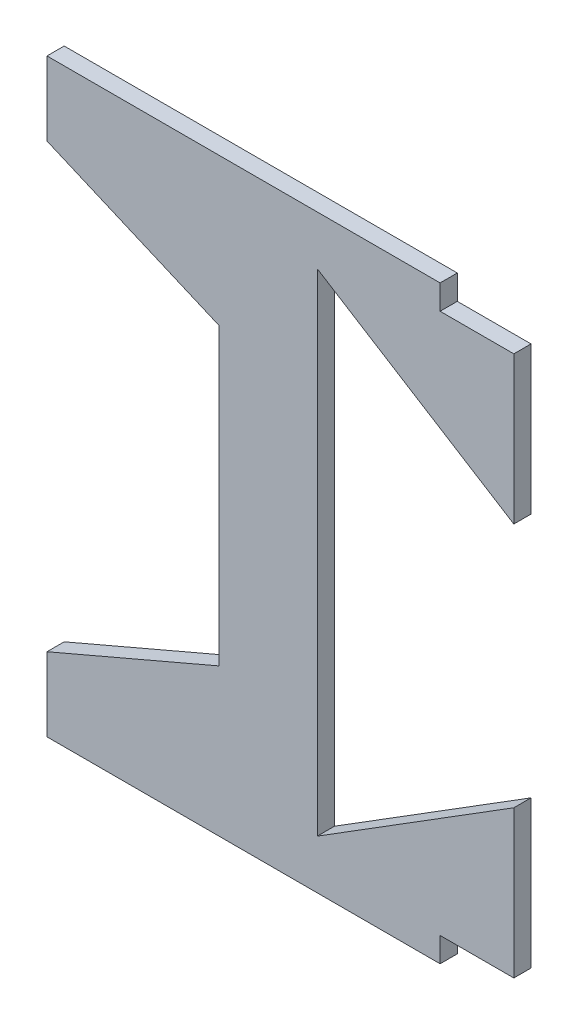
from build123d import *

# Parameters (mm, degrees)
AUFSATZ_LINEAR_AUSTRAGEN1_DEPTH = 3.5


with BuildPart() as part:
    # Skizze1 → Aufsatz-Linear austragen1 (new body)
    with BuildSketch(Plane.XY):
        Polygon((30.285470489, 30), (30.285470489, -30), (-4.714529511, -45), (-4.714529511, -60), (75.285470489, -60), (75.285470489, -55), (90.285470489, -55), (90.285470489, -25), (50.285470489, -50), (50.285470489, 50), (90.285470489, 25), (90.285470489, 55), (75.285470489, 55), (75.285470489, 60), (-4.714529511, 60), (-4.714529511, 45), align=None)
    extrude(amount=AUFSATZ_LINEAR_AUSTRAGEN1_DEPTH)


solid = part.part
